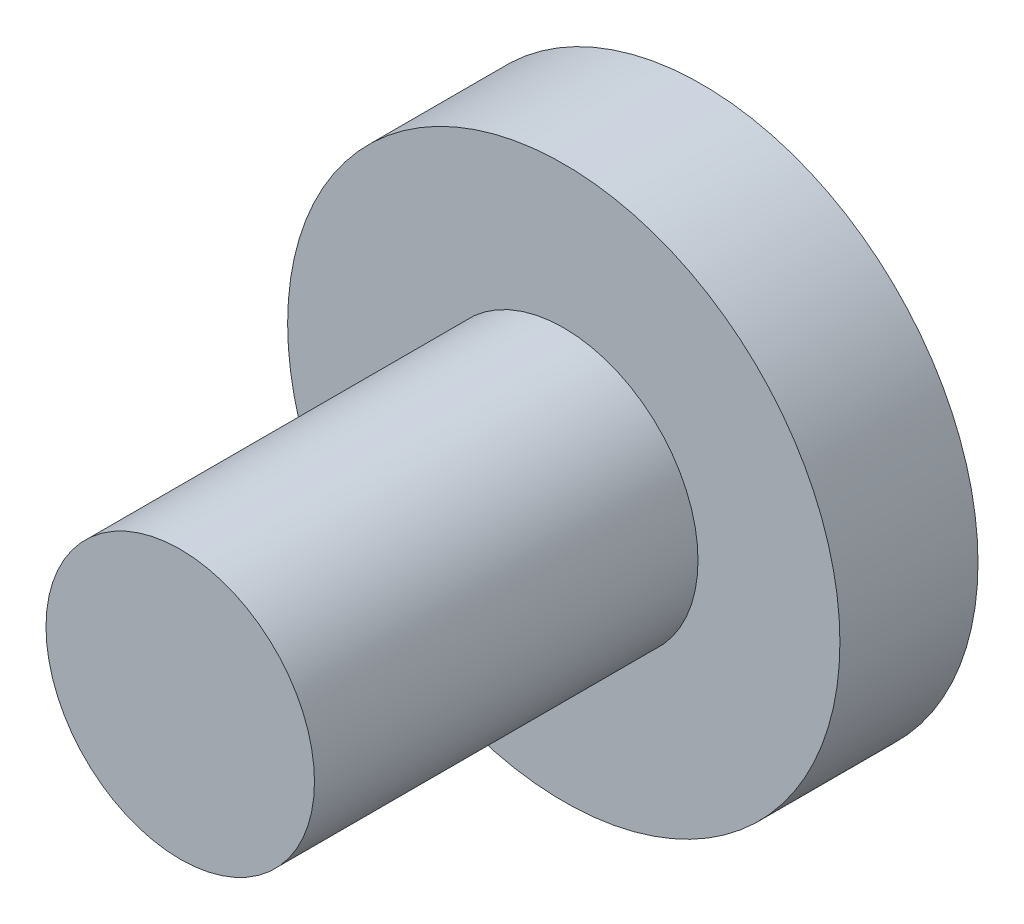
from build123d import *

# Parameters (mm, degrees)
SKETCH_1_R      = 3.6
EXTRUDE_1_DEPTH = 1.8
SKETCH_2_R      = 1.75
EXTRUDE_2_DEPTH = 5


with BuildPart() as part:
    # 草图1 → 凸台-拉伸1 (new body)
    with BuildSketch(Plane.XY):
        Circle(SKETCH_1_R)
    extrude(amount=EXTRUDE_1_DEPTH)

    # 草图2 → 凸台-拉伸2 (add)
    with BuildSketch(Plane.XY.offset(1.8)):
        Circle(SKETCH_2_R)
    extrude(amount=EXTRUDE_2_DEPTH)


solid = part.part
